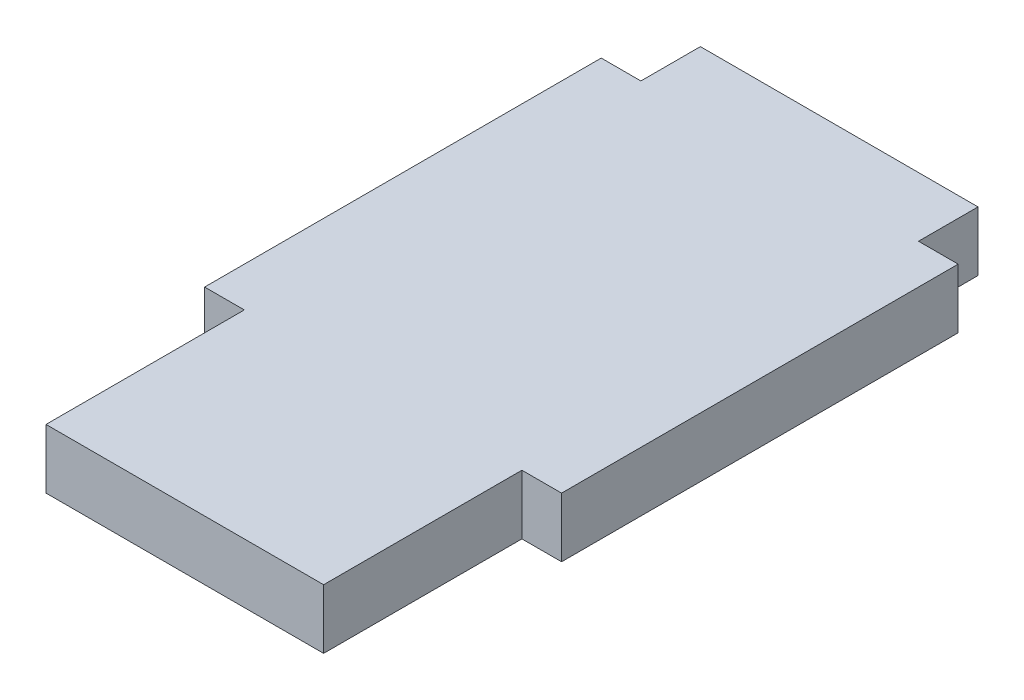
from build123d import *

# Parameters (mm, degrees)
EXTRUDE_1_DEPTH = 3
SKETCH_2_W      = 14
SKETCH_2_H      = 3
EXTRUDE_2_DEPTH = 3


with BuildPart() as part:
    # Эскиз1 → Бобышка-Вытянуть1 (new body)
    with BuildSketch(Plane(origin=(0, 0, 0), x_dir=(1, 0, 0), z_dir=(0, 1, 0))):
        Polygon((-7, -15), (7, -15), (7, -8), (9, -8), (9, 12), (7, 12), (7, 15), (-7, 15), (-7, 12), (-9, 12), (-9, -8), (-7, -8), align=None)
    extrude(amount=EXTRUDE_1_DEPTH)

    # Эскиз2 → Бобышка-Вытянуть2 (add)
    with BuildSketch(Plane.XY.offset(15)):
        with Locations((0, 1.5)):
            Rectangle(SKETCH_2_W, SKETCH_2_H)
    extrude(amount=EXTRUDE_2_DEPTH)


solid = part.part
